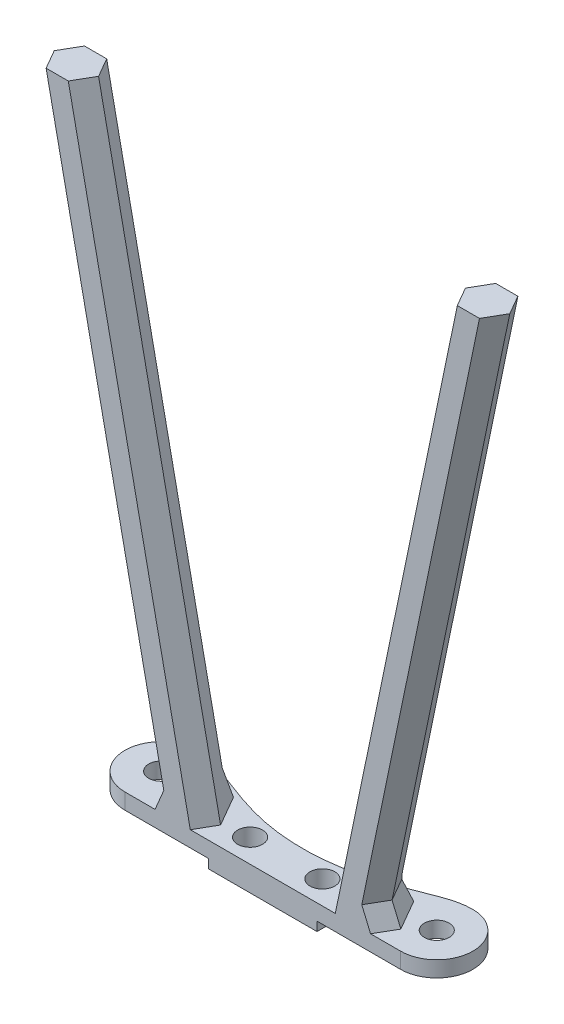
from build123d import *

# Parameters (mm, degrees)
SKETCH2_R                        = 1.375
BOSS_EXTRUDE1_DEPTH              = 1.75
CUT_EXTRUDE1_DEPTH               = 10
CHAMFER1_SIZE                    = 1.25
CHAMFER1_SIZE2                   = 3.434346774
CHAMFER1_EDGE_2_SIZE             = 1.25
CHAMFER1_EDGE_2_SIZE2            = 2.335367
CHAMFER1_EDGE_3_SIZE             = 1.25
CHAMFER1_EDGE_3_SIZE2            = 2.335367
CHAMFER1_OF_MIRROR1_SIZE2        = 3.434346774
CHAMFER1_OF_MIRROR1_SIZE         = 1.25
CHAMFER1_EDGE_2_OF_MIRROR1_SIZE2 = 2.335367
CHAMFER1_EDGE_2_OF_MIRROR1_SIZE  = 1.25
CHAMFER1_EDGE_3_OF_MIRROR1_SIZE2 = 2.335367
CHAMFER1_EDGE_3_OF_MIRROR1_SIZE  = 1.25
BOSS_EXTRUDE2_DEPTH              = 1
SKETCH8_R                        = 1.375
CUT_EXTRUDE2_DEPTH               = 80.009920224


with BuildPart() as part:
    # Sketch2 → Boss-Extrude1 (new body)
    with BuildSketch(Plane(origin=(0, 0, 0), x_dir=(1, 0, 0), z_dir=(0, 1, 0))):
        with BuildLine():
            Line((0, 4), (30.5, 4))
            ThreePointArc((30.5, 4), (34.5, 0), (30.5, -4))
            Line((30.5, -4), (0, -4))
            ThreePointArc((0, -4), (-4, 0), (0, 4))
        make_face()
        with Locations(Location((0, 0, 0), (0, 0, 270))):
            Circle(SKETCH2_R, mode=Mode.SUBTRACT)
        with Locations(Location((30.5, 0, 0), (0, 0, 270))):
            Circle(SKETCH2_R, mode=Mode.SUBTRACT)
    extrude(amount=BOSS_EXTRUDE1_DEPTH)

    # Sketch3 → Cut-Extrude1 (cut)
    with BuildSketch(Plane(origin=(0, 1.75, 0), x_dir=(1, 0, 0), z_dir=(0, 1, 0))):
        with BuildLine():
            Line((30.5, 4), (0, 4))
            add(Edge.make_bspline(
                [(0, 4), (1.392554105, 4), (4.712816119, 2.730302251), (11.200086309, 0.212313893), (19.274696625, 0.212313893), (25.842577961, 2.730302251), (29.028765437, 4), (30.5, 4)],
                knots=[0, 0, 0, 0, 0.131328662, 0.332777634, 0.667222366, 0.868671338, 1, 1, 1, 1], degree=3))
        make_face()
    extrude(amount=-CUT_EXTRUDE1_DEPTH, mode=Mode.SUBTRACT)

    # Sketch4 → Loft1 section 0
    with BuildSketch(Plane(origin=(0, 1.75, 0), x_dir=(1, 0, 0), z_dir=(0, 1, 0))):
        with BuildLine():
            Line((8.453738644, -1.875), (7.226869322, 0.25))
            Line((7.226869322, 0.25), (4.773130678, 0.25))
            Line((4.773130678, 0.25), (3.546261356, -1.875))
            Line((3.546261356, -1.875), (4.773130678, -4))
            Line((4.773130678, -4), (7.226869322, -4))
            Line((7.226869322, -4), (8.453738644, -1.875))
        make_face()
    # Sketch5 → Loft1 section 1
    with BuildSketch(Plane(origin=(0, 66.75, 0), x_dir=(1, 0, 0), z_dir=(0, 1, 0))):
        with BuildLine():
            Line((-5.046261356, -1.875), (-6.273130678, 0.25))
            Line((-6.273130678, 0.25), (-8.726869322, 0.25))
            Line((-8.726869322, 0.25), (-9.953738644, -1.875))
            Line((-9.953738644, -1.875), (-8.726869322, -4))
            Line((-8.726869322, -4), (-6.273130678, -4))
            Line((-6.273130678, -4), (-5.046261356, -1.875))
        make_face()
    loft1 = loft()

    # Chamfer1
    chamfer1_edges = [part.edges().sort_by_distance(p)[0] for p in [
        (6, 1.75, -0.25),
    ]]
    chamfer1_side = [part.faces().sort_by_distance(p)[0] for p in [
        (15.962582186, 1.75, 0.665337448),
    ]]
    chamfer(chamfer1_edges, length=CHAMFER1_SIZE, length2=CHAMFER1_SIZE2, reference=chamfer1_side[0])

    # Chamfer1 edge 2
    chamfer1_edge_2_edges = [part.edges().sort_by_distance(p)[0] for p in [
        (4.159696017, 1.75, 0.8125),
    ]]
    chamfer1_edge_2_side = [part.faces().sort_by_distance(p)[0] for p in [
        (15.962582186, 1.75, 0.665337448),
    ]]
    chamfer(chamfer1_edge_2_edges, length=CHAMFER1_EDGE_2_SIZE, length2=CHAMFER1_EDGE_2_SIZE2, reference=chamfer1_edge_2_side[0])

    # Chamfer1 edge 3
    chamfer1_edge_3_edges = [part.edges().sort_by_distance(p)[0] for p in [
        (4.159696017, 1.75, 2.9375),
    ]]
    chamfer1_edge_3_side = [part.faces().sort_by_distance(p)[0] for p in [
        (15.962582186, 1.75, 0.665337448),
    ]]
    chamfer(chamfer1_edge_3_edges, length=CHAMFER1_EDGE_3_SIZE, length2=CHAMFER1_EDGE_3_SIZE2, reference=chamfer1_edge_3_side[0])

    # Mirror1: Loft1 across plane
    add(loft1.mirror(Plane(origin=(15.25, 0, 0), x_dir=(0, 0, 1), z_dir=(1, 0, 0))))

    # Chamfer1 of Mirror1
    chamfer1_of_mirror1_edges = [part.edges().sort_by_distance(p)[0] for p in [
        (24.5, 1.75, -0.25),
    ]]
    chamfer(chamfer1_of_mirror1_edges, length=CHAMFER1_OF_MIRROR1_SIZE, length2=CHAMFER1_OF_MIRROR1_SIZE2)

    # Chamfer1 edge 2 of Mirror1
    chamfer1_edge_2_of_mirror1_edges = [part.edges().sort_by_distance(p)[0] for p in [
        (26.340303983, 1.75, 0.8125),
    ]]
    chamfer(chamfer1_edge_2_of_mirror1_edges, length=CHAMFER1_EDGE_2_OF_MIRROR1_SIZE, length2=CHAMFER1_EDGE_2_OF_MIRROR1_SIZE2)

    # Chamfer1 edge 3 of Mirror1
    chamfer1_edge_3_of_mirror1_edges = [part.edges().sort_by_distance(p)[0] for p in [
        (26.340303983, 1.75, 2.9375),
    ]]
    chamfer(chamfer1_edge_3_of_mirror1_edges, length=CHAMFER1_EDGE_3_OF_MIRROR1_SIZE, length2=CHAMFER1_EDGE_3_OF_MIRROR1_SIZE2)

    # Sketch6 → Boss-Extrude2 (add)
    with BuildSketch(Plane.XZ):
        with BuildLine():
            Line((9.25, 4), (9.25, -1.186704991))
            add(Edge.make_bspline(
                [(9.25, -1.186704991), (9.498756449, -1.120525729), (13.135912237, -0.212313893), (17.336765902, -0.212313893), (21.001177664, -1.119553839), (21.25, -1.185159308)],
                knots=[0.308100917, 0.308100917, 0.308100917, 0.308100917, 0.332777634, 0.667222366, 0.691706881, 0.691706881, 0.691706881, 0.691706881], degree=3))
            Line((21.25, -1.185159308), (21.25, 4))
            Line((21.25, 4), (9.25, 4))
        make_face()
    extrude(amount=BOSS_EXTRUDE2_DEPTH)

    # Sketch8 → Cut-Extrude2 (cut, through all)
    with BuildSketch(Plane.XZ.offset(1)):
        with Locations(Location((11.249999996, 1.406776311, 0), (0, 0, 270))):
            Circle(SKETCH8_R)
        with Locations(Location((19.250000004, 1.407291539, 0), (0, 0, 270))):
            Circle(SKETCH8_R)
    extrude(amount=-CUT_EXTRUDE2_DEPTH, mode=Mode.SUBTRACT)


solid = part.part
